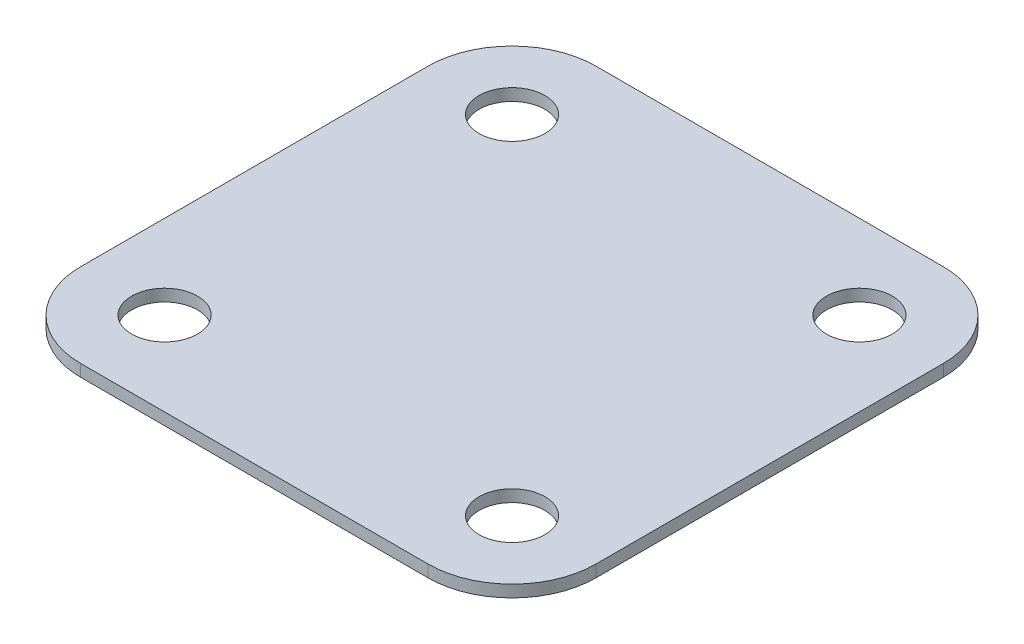
from build123d import *

# Parameters (mm, degrees)
SKETCH_1_W               = 86
SKETCH_1_H               = 86
EXTRUDE_1_DEPTH          = 2
FILLET_3_R               = 14
CUT_EXTRUDE_1_DEPTH      = 61.844062981
CUT_EXTRUDE_1_DEPTH_BACK = 61.844062981
SKETCH_2_R               = 5.5


with BuildPart() as part:
    # 草图1 → 凸台-拉伸1 (new body)
    with BuildSketch(Plane(origin=(0, 0, 0), x_dir=(1, 0, 0), z_dir=(0, 1, 0))):
        Rectangle(SKETCH_1_W, SKETCH_1_H)
    extrude(amount=EXTRUDE_1_DEPTH)

    # 圆角3
    fillet_3_edges = [part.edges().sort_by_distance(p)[0] for p in [
        (43, 1, 43),
        (-43, 1, 43),
        (-43, 1, -43),
        (43, 1, -43),
    ]]
    fillet(fillet_3_edges, radius=FILLET_3_R)

    # 草图2 → 切除-拉伸1 (cut, two sides: drawn at the far end of the back side and taken through both)
    with BuildSketch(Plane(origin=(0, 2, 0), x_dir=(1, 0, 0), z_dir=(0, 1, 0)).offset(-CUT_EXTRUDE_1_DEPTH_BACK)):
        with Locations(Location((-29, 29, 0), (0, 0, 270))):
            Circle(SKETCH_2_R)
        with Locations(Location((-29, -29, 0), (0, 0, 270))):
            Circle(SKETCH_2_R)
        with Locations(Location((29, -29, 0), (0, 0, 270))):
            Circle(SKETCH_2_R)
        with Locations(Location((29, 29, 0), (0, 0, 270))):
            Circle(SKETCH_2_R)
    extrude(amount=CUT_EXTRUDE_1_DEPTH + CUT_EXTRUDE_1_DEPTH_BACK, mode=Mode.SUBTRACT)


solid = part.part
